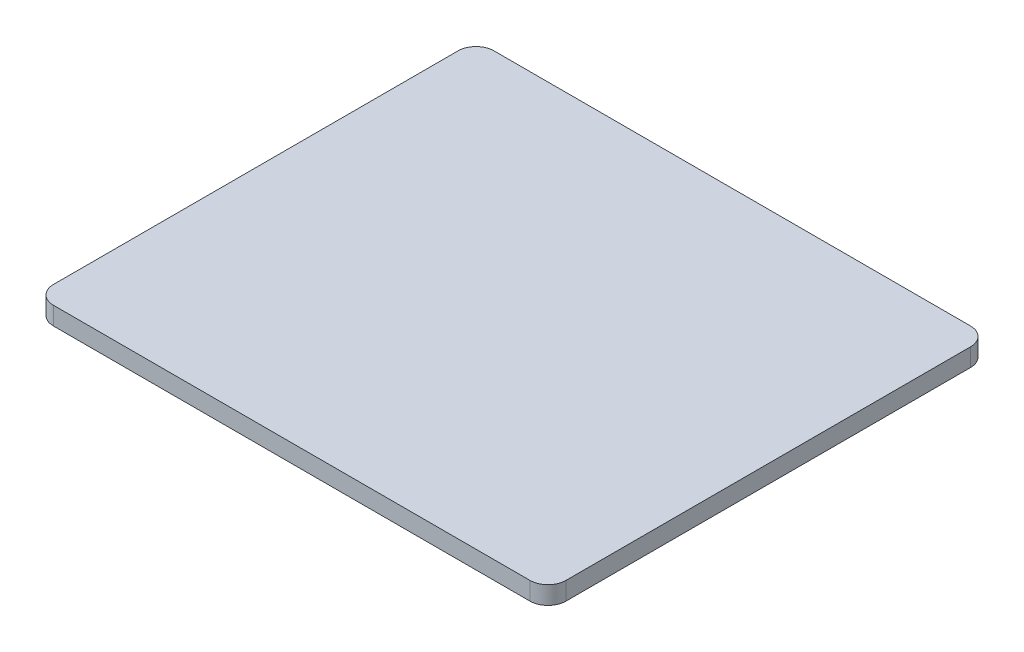
from build123d import *

# Parameters (mm, degrees)
EXTRUDE_1_DEPTH = 2


with BuildPart() as part:
    # 草图1 → 凸台-拉伸1 (new body)
    with BuildSketch(Plane(origin=(0, 0, 0), x_dir=(1, 0, 0), z_dir=(0, 1, 0))):
        with BuildLine():
            Line((-26.5, -24.5), (26.5, -24.5))
            ThreePointArc((26.5, -24.5), (27.914213562, -23.914213562), (28.5, -22.5))
            Line((28.5, -22.5), (28.5, 22.5))
            ThreePointArc((28.5, 22.5), (27.914213562, 23.914213562), (26.5, 24.5))
            Line((26.5, 24.5), (-26.5, 24.5))
            ThreePointArc((-26.5, 24.5), (-27.914213562, 23.914213562), (-28.5, 22.5))
            Line((-28.5, 22.5), (-28.5, -22.5))
            ThreePointArc((-28.5, -22.5), (-27.914213562, -23.914213562), (-26.5, -24.5))
        make_face()
    extrude(amount=EXTRUDE_1_DEPTH)


solid = part.part
